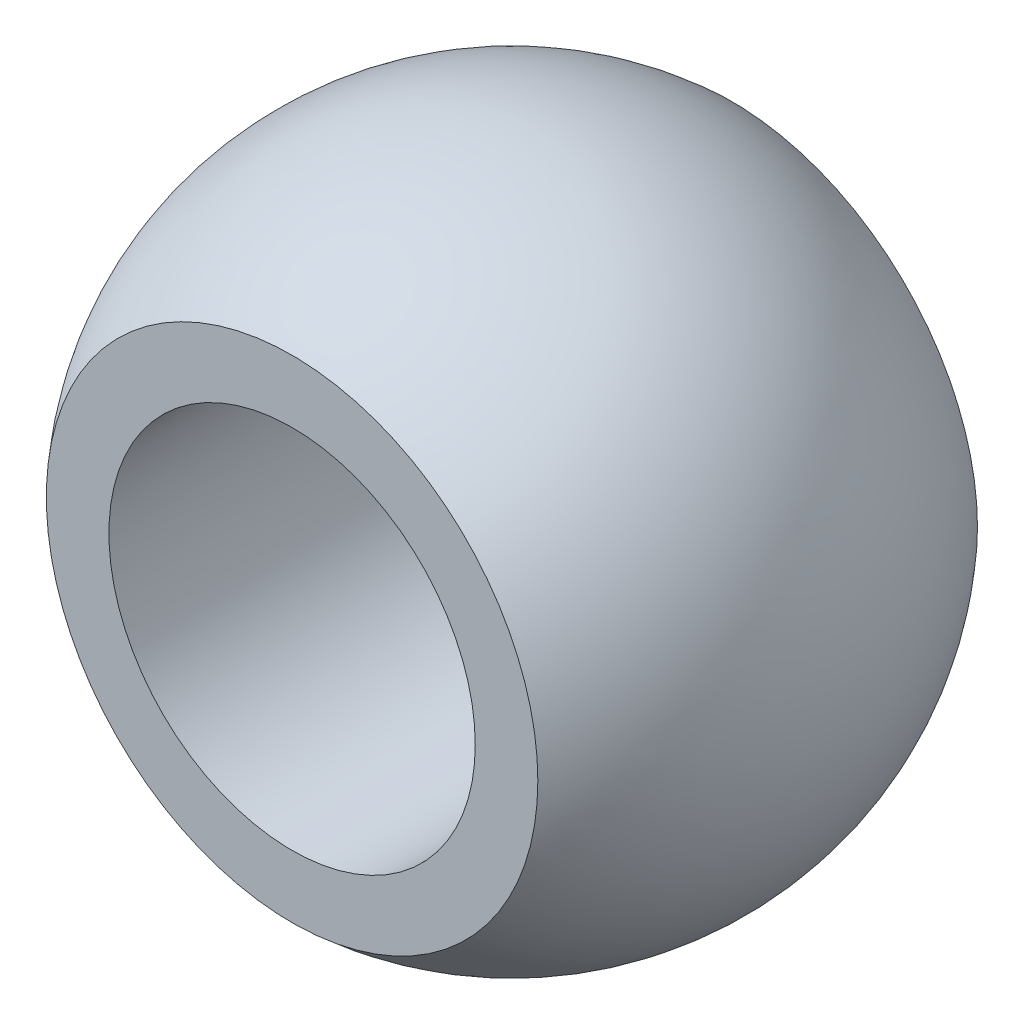
from build123d import *

# Parameters (mm, degrees)
SKETCH2_R      = 7.9375
EXTRUDE1_DEPTH = 25.4
EXTRUDE2_REACH = 33.23
SKETCH3_R      = 14.2875


with BuildPart() as part:
    # Sketch1 → Revolve1 (revolve)
    with BuildSketch(Plane.XY):
        with BuildLine():
            Line((0, 14.2875), (0, -14.2875))
            ThreePointArc((0, -14.2875), (14.2875, 0), (0, 14.2875))
        make_face()
    revolve(axis=Axis((0, -14.2875, 0), (0, 1, 0)))

    # Sketch2 → Extrude1 (cut, symmetric)
    with BuildSketch(Plane.XY):
        with Locations(Location((0, 0, 0), (0, 0, 180))):
            Circle(SKETCH2_R)
    extrude(amount=EXTRUDE1_DEPTH, both=True, mode=Mode.SUBTRACT)

    # Sketch3 → Extrude2 (cut, up to next)
    with BuildSketch(Plane.XY.offset(9.525), mode=Mode.PRIVATE) as extrude2_sk1:
        Circle(SKETCH3_R)
    extrude2_tool1 = extrude(extrude2_sk1.sketch, amount=EXTRUDE2_REACH, mode=Mode.PRIVATE) & part.part
    extrude2 = extrude2_tool1.solids().sort_by_distance((0, 0, 9.525))[0]
    add(extrude2, mode=Mode.SUBTRACT)

    # Mirror1: Extrude2 across plane
    add(extrude2.mirror(Plane.XY), mode=Mode.SUBTRACT)


solid = part.part
